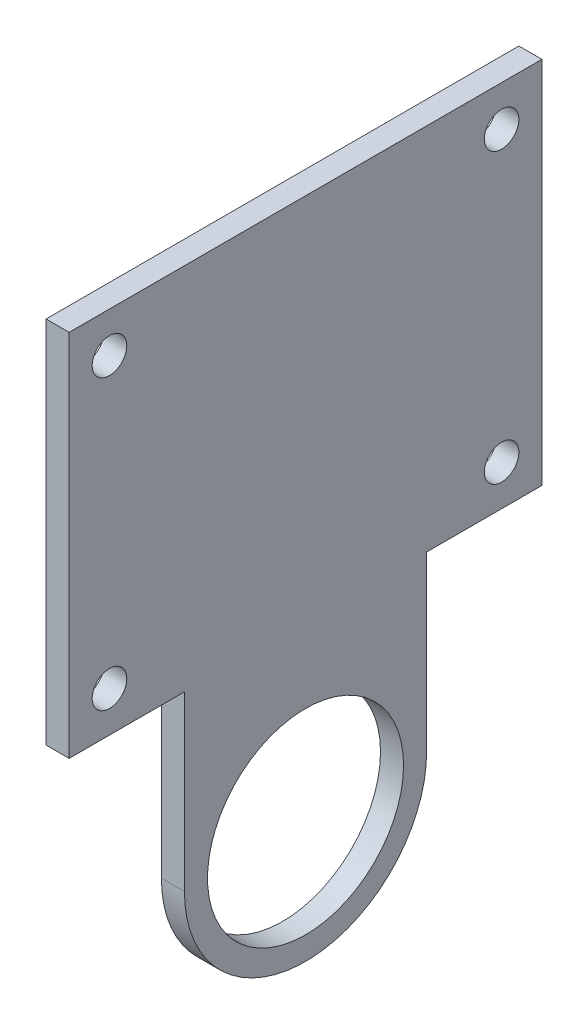
from build123d import *

# Parameters (mm, degrees)
SKETCH_1_R      = 8.5
SKETCH_1_R_2    = 1.5
EXTRUDE_1_DEPTH = 2


with BuildPart() as part:
    # 草图1 → 凸台-拉伸1 (new body)
    with BuildSketch(Plane(origin=(0, 0, 0), x_dir=(0, 0, -1), z_dir=(1, 0, 0))):
        with BuildLine():
            Line((-10.5, 0), (-10.5, 15))
            Line((-10.5, 15), (-20.5, 15))
            Line((-20.5, 15), (-20.5, 47))
            Line((-20.5, 47), (20.5, 47))
            Line((20.5, 47), (20.5, 15))
            Line((20.5, 15), (10.5, 15))
            Line((10.5, 15), (10.5, 0))
            ThreePointArc((10.5, 0), (0, -10.5), (-10.5, 0))
        make_face()
        Circle(SKETCH_1_R, mode=Mode.SUBTRACT)
        with Locations((-17, 43.5)):
            Circle(SKETCH_1_R_2, mode=Mode.SUBTRACT)
        with Locations((17, 43.5)):
            Circle(SKETCH_1_R_2, mode=Mode.SUBTRACT)
        with Locations((-17, 18.5)):
            Circle(SKETCH_1_R_2, mode=Mode.SUBTRACT)
        with Locations((17, 18.5)):
            Circle(SKETCH_1_R_2, mode=Mode.SUBTRACT)
    extrude(amount=EXTRUDE_1_DEPTH)


solid = part.part
